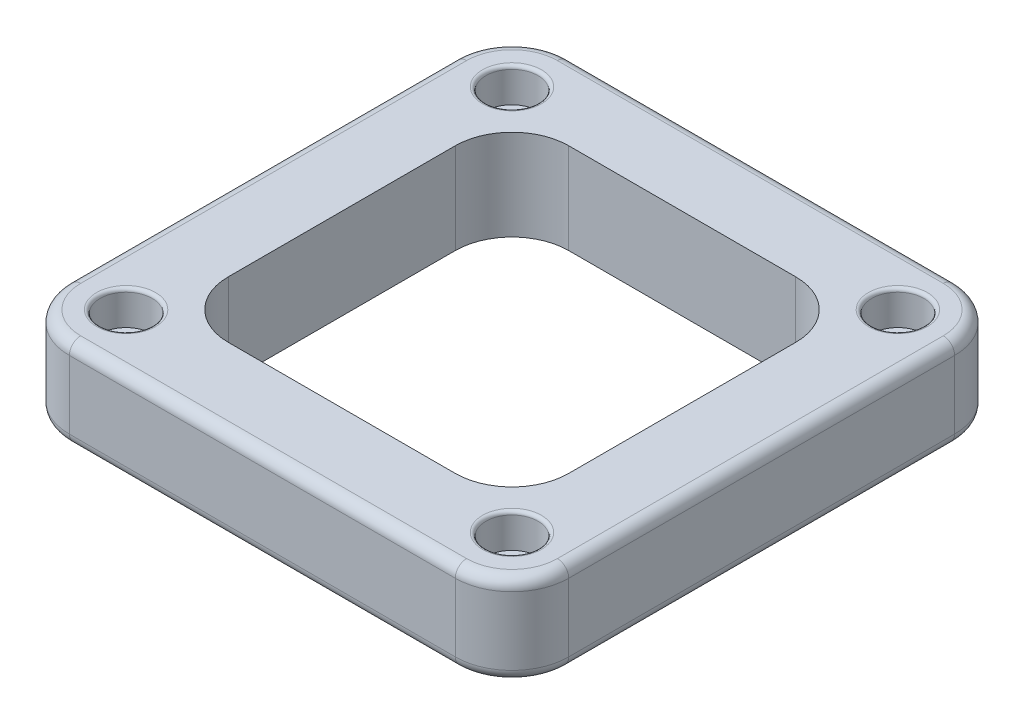
from build123d import *

# Parameters (mm, degrees)
SKETCH_1_W                                       = 44
SKETCH_1_H                                       = 44
EXTRUDE_1_DEPTH                                  = 8
CBORE_FOR_M2_HEX_HEAD_MACHINE_SCREW1_D           = 2.2
CBORE_FOR_M2_HEX_HEAD_MACHINE_SCREW1_CBORE_D     = 4.6
CBORE_FOR_M2_HEX_HEAD_MACHINE_SCREW1_CBORE_DEPTH = 3
MIRROR_1_AT_THE_SECOND_PLANE_COPY_1_D            = 2.2
MIRROR_1_AT_THE_SECOND_PLANE_COPY_1_CBORE_D      = 4.6
MIRROR_1_AT_THE_SECOND_PLANE_COPY_1_CBORE_DEPTH  = 3
FILLET_2_R                                       = 5
FILLET_3_R                                       = 5
FILLET_4_R                                       = 5
FILLET_5_R                                       = 5
FILLET_6_R                                       = 1
FILLET_7_R                                       = 0.3
SKETCH_7_W                                       = 30
SKETCH_7_H                                       = 30
CUT_EXTRUDE_2_DEPTH                              = 33.124756808
FILLET_8_R                                       = 5
FILLET_9_R                                       = 5
FILLET_10_R                                      = 5
FILLET_11_R                                      = 5


with BuildPart() as part:
    # 草图1 → 凸台-拉伸1 (new body)
    with BuildSketch(Plane(origin=(0, 0, 0), x_dir=(1, 0, 0), z_dir=(0, 1, 0))):
        Rectangle(SKETCH_1_W, SKETCH_1_H)
    extrude(amount=EXTRUDE_1_DEPTH)

    # CBORE for M2 Hex Head Machine Screw1 (through all)
    with Locations(Plane(origin=(0, 8, 0), x_dir=(1, 0, 0), z_dir=(0, 1, 0))):
        with Locations((-17, 17)):
            cbore_for_m2_hex_head_machine_screw1 = CounterBoreHole(CBORE_FOR_M2_HEX_HEAD_MACHINE_SCREW1_D / 2, CBORE_FOR_M2_HEX_HEAD_MACHINE_SCREW1_CBORE_D / 2, CBORE_FOR_M2_HEX_HEAD_MACHINE_SCREW1_CBORE_DEPTH)

    # 镜向1: CBORE for M2 Hex Head Machine Screw1 across plane
    add(cbore_for_m2_hex_head_machine_screw1.mirror(Plane.XY), mode=Mode.SUBTRACT)

    # 镜向1 at the second plane: CBORE for M2 Hex Head Machine Screw1 across plane
    add(cbore_for_m2_hex_head_machine_screw1.mirror(Plane(origin=(0, 0, 0), x_dir=(0, 0, 1), z_dir=(1, 0, 0))), mode=Mode.SUBTRACT)

    # 镜向1 at the second plane copy 1 (through all)
    with Locations(Plane(origin=(0, 8, 0), x_dir=(-1, 0, 0), z_dir=(0, 1, 0))):
        with Locations((-17, 17)):
            CounterBoreHole(MIRROR_1_AT_THE_SECOND_PLANE_COPY_1_D / 2, MIRROR_1_AT_THE_SECOND_PLANE_COPY_1_CBORE_D / 2, MIRROR_1_AT_THE_SECOND_PLANE_COPY_1_CBORE_DEPTH)

    # 圆角2
    fillet_2_edges = [part.edges().sort_by_distance(p)[0] for p in [
        (-22, 4, -22),
    ]]
    fillet(fillet_2_edges, radius=FILLET_2_R)

    # 圆角3
    fillet_3_edges = [part.edges().sort_by_distance(p)[0] for p in [
        (22, 4, -22),
    ]]
    fillet(fillet_3_edges, radius=FILLET_3_R)

    # 圆角4
    fillet_4_edges = [part.edges().sort_by_distance(p)[0] for p in [
        (22, 4, 22),
    ]]
    fillet(fillet_4_edges, radius=FILLET_4_R)

    # 圆角5
    fillet_5_edges = [part.edges().sort_by_distance(p)[0] for p in [
        (-22, 4, 22),
    ]]
    fillet(fillet_5_edges, radius=FILLET_5_R)

    # 圆角6
    fillet_6_edges = [part.edges().sort_by_distance(p)[0] for p in [
        (-22, 0, 0),
        (-22, 8, 0),
        (-20.535533906, 8, -20.535533906),
        (-20.535533906, 0, -20.535533906),
        (0, 0, -22),
        (0, 8, -22),
        (20.535533906, 0, -20.535533906),
        (20.535533906, 8, -20.535533906),
        (22, 0, 0),
        (22, 8, 0),
        (20.535533906, 8, 20.535533906),
        (20.535533906, 0, 20.535533906),
        (0, 0, 22),
        (0, 8, 22),
        (-20.535533906, 8, 20.535533906),
        (-20.535533906, 0, 20.535533906),
    ]]
    fillet(fillet_6_edges, radius=FILLET_6_R)

    # 圆角7
    fillet_7_edges = [part.edges().sort_by_distance(p)[0] for p in [
        (-19.3, 8, -17),
        (19.3, 8, -17),
        (-19.3, 8, 17),
        (19.3, 8, 17),
    ]]
    fillet(fillet_7_edges, radius=FILLET_7_R)

    # 草图7 → 切除-拉伸2 (cut, through all)
    with BuildSketch(Plane(origin=(0, 8, 0), x_dir=(1, 0, 0), z_dir=(0, 1, 0))):
        Rectangle(SKETCH_7_W, SKETCH_7_H)
    extrude(amount=-CUT_EXTRUDE_2_DEPTH, mode=Mode.SUBTRACT)

    # 圆角8
    fillet_8_edges = [part.edges().sort_by_distance(p)[0] for p in [
        (-15, 4, -15),
    ]]
    fillet(fillet_8_edges, radius=FILLET_8_R)

    # 圆角9
    fillet_9_edges = [part.edges().sort_by_distance(p)[0] for p in [
        (15, 4, -15),
    ]]
    fillet(fillet_9_edges, radius=FILLET_9_R)

    # 圆角10
    fillet_10_edges = [part.edges().sort_by_distance(p)[0] for p in [
        (15, 4, 15),
    ]]
    fillet(fillet_10_edges, radius=FILLET_10_R)

    # 圆角11
    fillet_11_edges = [part.edges().sort_by_distance(p)[0] for p in [
        (-15, 4, 15),
    ]]
    fillet(fillet_11_edges, radius=FILLET_11_R)


solid = part.part
